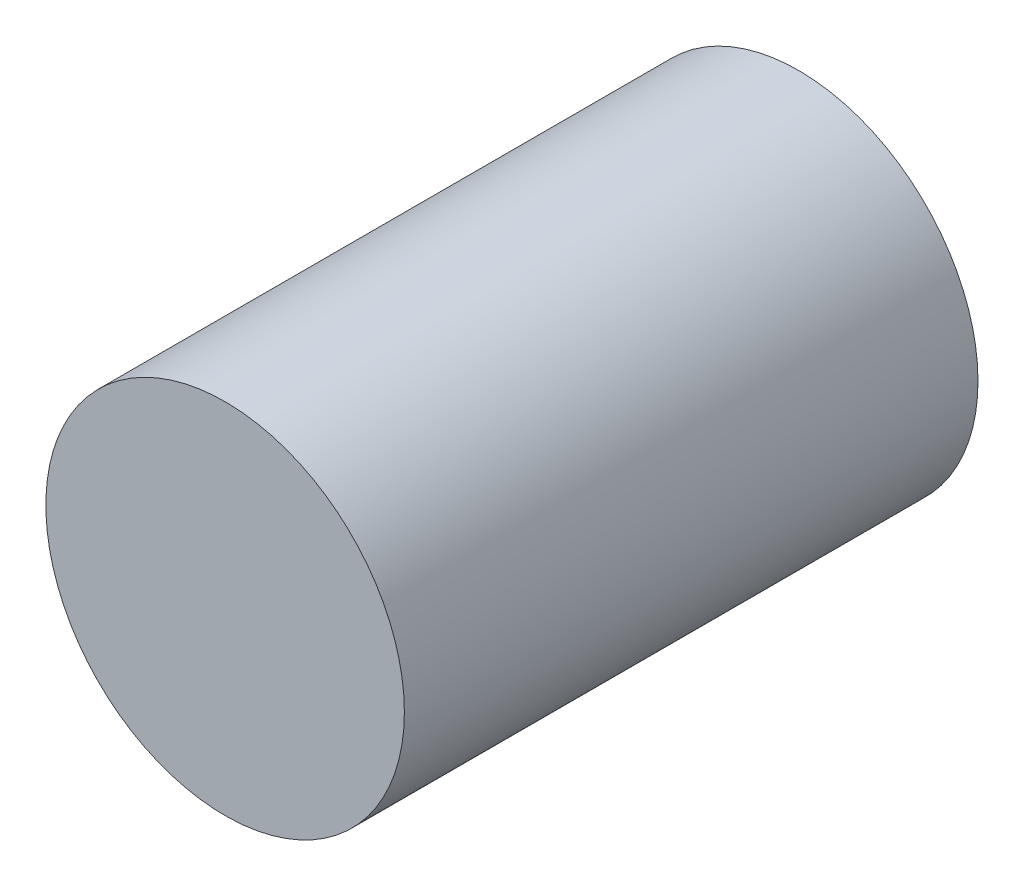
from build123d import *

# Parameters (mm, degrees)
SKETCH1_R           = 12.5
BOSS_EXTRUDE1_DEPTH = 40


with BuildPart() as part:
    # Sketch1 → Boss-Extrude1 (new body)
    with BuildSketch(Plane.XY):
        Circle(SKETCH1_R)
    extrude(amount=BOSS_EXTRUDE1_DEPTH)


solid = part.part
